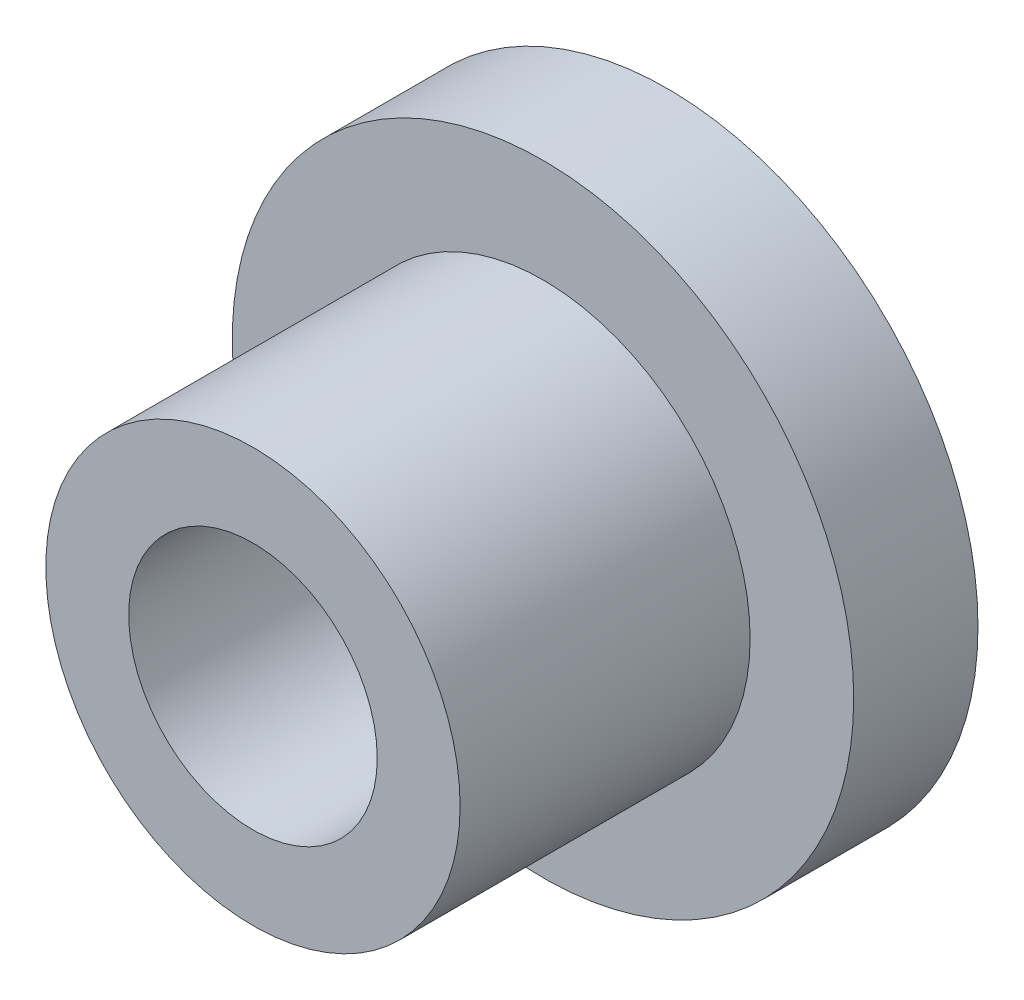
from build123d import *


with BuildPart() as part:
    # Çizim2 → Döndür1 (revolve)
    with BuildSketch(Plane(origin=(0, 0, 0), x_dir=(0, 0, -1), z_dir=(1, 0, 0)), mode=Mode.PRIVATE) as d_nd_r1_sk:
        Polygon((-14.325955734, 10), (-0.325955734, 10), (-0.325955734, 15), (5.674044266, 15), (5.674044266, 6), (-2.816901408, 6), (-14.325955734, 6), align=None)
    revolve(d_nd_r1_sk.sketch.rotate(Axis((0, 0, 17.585513078), (0, 0, -1)), 90), axis=Axis((0, 0, 17.585513078), (0, 0, -1)))


solid = part.part
